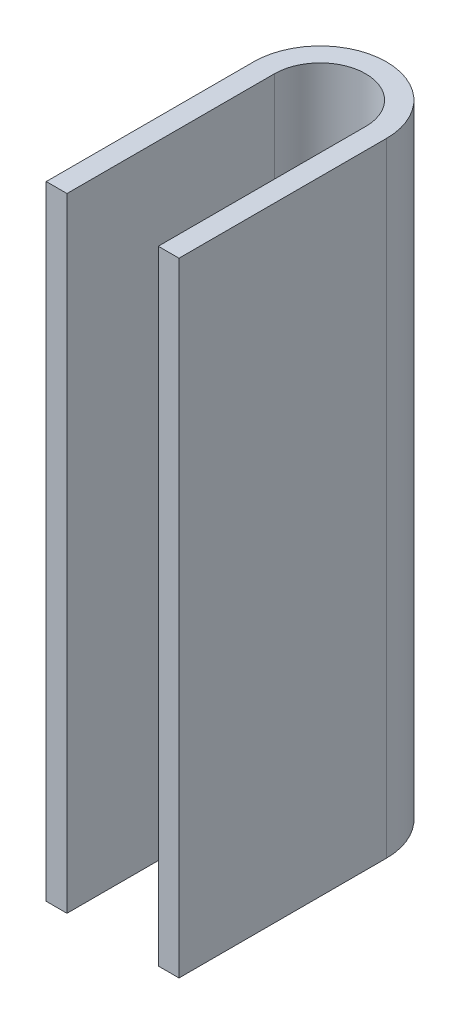
from build123d import *

# Parameters (mm, degrees)
BOSS_EXTRUDE1_DEPTH = 300.5


with BuildPart() as part:
    # Sketch1 → Boss-Extrude1 (new body)
    with BuildSketch(Plane(origin=(0, 0, 0), x_dir=(1, 0, 0), z_dir=(0, 1, 0))):
        with BuildLine():
            Line((0, 0), (0, -100))
            Line((0, -100), (-10, -100))
            Line((-10, -100), (-10, 0))
            ThreePointArc((-10, 0), (22, 32), (54, 0))
            Line((54, 0), (54, -100))
            Line((54, -100), (44, -100))
            Line((44, -100), (44, 0))
            ThreePointArc((44, 0), (22, 22), (0, 0))
        make_face()
    extrude(amount=BOSS_EXTRUDE1_DEPTH)


solid = part.part
